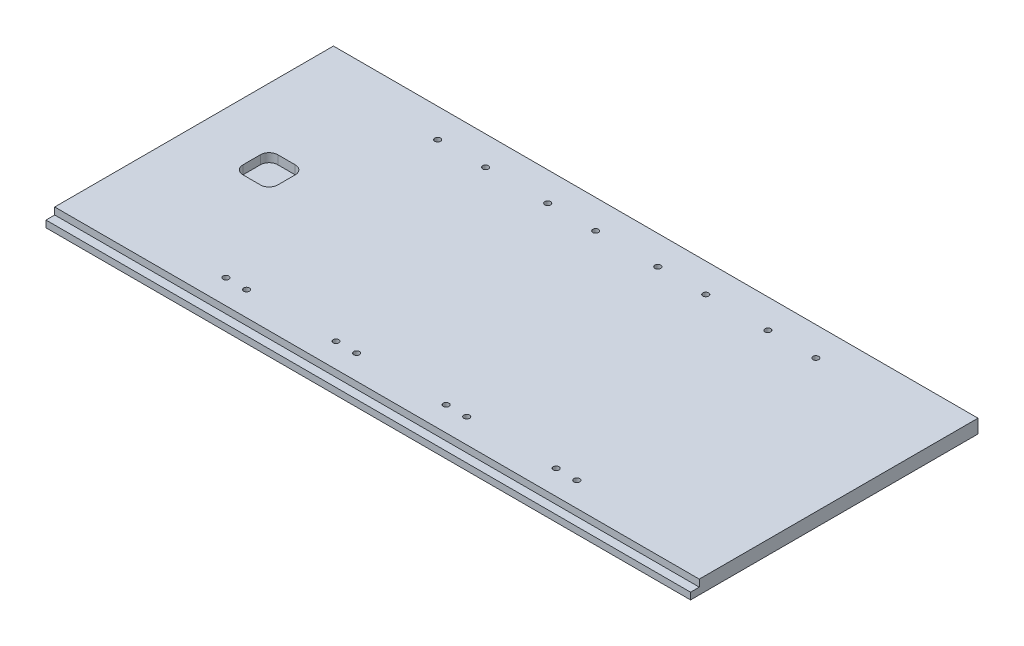
from build123d import *

# Parameters (mm, degrees)
SKETCH3_W           = 469.9
SKETCH3_H           = 209.55
BOSS_EXTRUDE1_DEPTH = 10
SKETCH4_R           = 2.1
CUT_EXTRUDE3_DEPTH  = 258.447670654
SKETCH5_R           = 2.1
CUT_EXTRUDE4_DEPTH  = 258.447670654
SKETCH7_W           = 25.4
SKETCH7_H           = 25.4
CUT_EXTRUDE5_DEPTH  = 6.35
CUT_EXTRUDE6_REACH  = 483.543
SKETCH8_W           = 6.35
SKETCH8_H           = 5.08
FILLET1_R           = 6.35


with BuildPart() as part:
    # Sketch3 → Boss-Extrude1 (new body)
    with BuildSketch(Plane(origin=(0, 0, 0), x_dir=(1, 0, 0), z_dir=(0, 1, 0))):
        Rectangle(SKETCH3_W, SKETCH3_H)
    extrude(amount=BOSS_EXTRUDE1_DEPTH)

    # Sketch4 → Cut-Extrude3 (cut, through all)
    with BuildSketch(Plane(origin=(0, 10, 0), x_dir=(1, 0, 0), z_dir=(0, 1, 0))):
        with Locations(Location((-102.9, 83.65, 0), (0, 0, 270))):
            Circle(SKETCH4_R)
        with Locations(Location((-22.65, 83.65, 0), (0, 0, 270))):
            Circle(SKETCH4_R)
        with Locations(Location((57.6, 83.65, 0), (0, 0, 270))):
            Circle(SKETCH4_R)
        with Locations(Location((137.85, 83.65, 0), (0, 0, 270))):
            Circle(SKETCH4_R)
        with Locations(Location((112.85, -80.65, 0), (0, 0, 270))):
            Circle(SKETCH4_R)
        with Locations(Location((32.6, -80.65, 0), (0, 0, 270))):
            Circle(SKETCH4_R)
        with Locations(Location((-47.65, -80.65, 0), (0, 0, 270))):
            Circle(SKETCH4_R)
        with Locations(Location((-127.9, -80.65, 0), (0, 0, 270))):
            Circle(SKETCH4_R)
    extrude(amount=-CUT_EXTRUDE3_DEPTH, mode=Mode.SUBTRACT)

    # Sketch5 → Cut-Extrude4 (cut, through all)
    with BuildSketch(Plane(origin=(0, 10, 0), x_dir=(1, 0, 0), z_dir=(0, 1, 0))):
        with Locations(Location((-137.85, 83.65, 0), (0, 0, 270))):
            Circle(SKETCH5_R)
        with Locations(Location((-57.6, 83.65, 0), (0, 0, 270))):
            Circle(SKETCH5_R)
        with Locations(Location((22.65, 83.65, 0), (0, 0, 270))):
            Circle(SKETCH5_R)
        with Locations(Location((102.9, 83.65, 0), (0, 0, 270))):
            Circle(SKETCH5_R)
        with Locations(Location((-112.85, -80.65, 0), (0, 0, 270))):
            Circle(SKETCH5_R)
        with Locations(Location((-32.6, -80.65, 0), (0, 0, 270))):
            Circle(SKETCH5_R)
        with Locations(Location((47.65, -80.65, 0), (0, 0, 270))):
            Circle(SKETCH5_R)
        with Locations(Location((127.9, -80.65, 0), (0, 0, 270))):
            Circle(SKETCH5_R)
    extrude(amount=-CUT_EXTRUDE4_DEPTH, mode=Mode.SUBTRACT)

    # Sketch7 → Cut-Extrude5 (cut)
    with BuildSketch(Plane(origin=(0, 10, 0), x_dir=(1, 0, 0), z_dir=(0, 1, 0))):
        with Locations((-180.25, 3.175)):
            Rectangle(SKETCH7_W, SKETCH7_H)
    extrude(amount=-CUT_EXTRUDE5_DEPTH, mode=Mode.SUBTRACT)

    # Sketch8 → Cut-Extrude6 (cut, up to next)
    with BuildSketch(Plane.ZY.offset(234.95), mode=Mode.PRIVATE) as cut_extrude6_sk1:
        with Locations((101.6, 7.46)):
            Rectangle(SKETCH8_W, SKETCH8_H)
    cut_extrude6_tool1 = extrude(cut_extrude6_sk1.sketch, amount=-CUT_EXTRUDE6_REACH, mode=Mode.PRIVATE) & part.part
    add(cut_extrude6_tool1.solids().sort_by_distance((-234.95, 7.46, 101.6))[0], mode=Mode.SUBTRACT)

    # Fillet1
    fillet1_edges = [part.edges().sort_by_distance(p)[0] for p in [
        (-167.55, 6.825, -15.875),
        (-167.55, 6.825, 9.525),
        (-192.95, 6.825, 9.525),
        (-192.95, 6.825, -15.875),
    ]]
    fillet(fillet1_edges, radius=FILLET1_R)


solid = part.part
